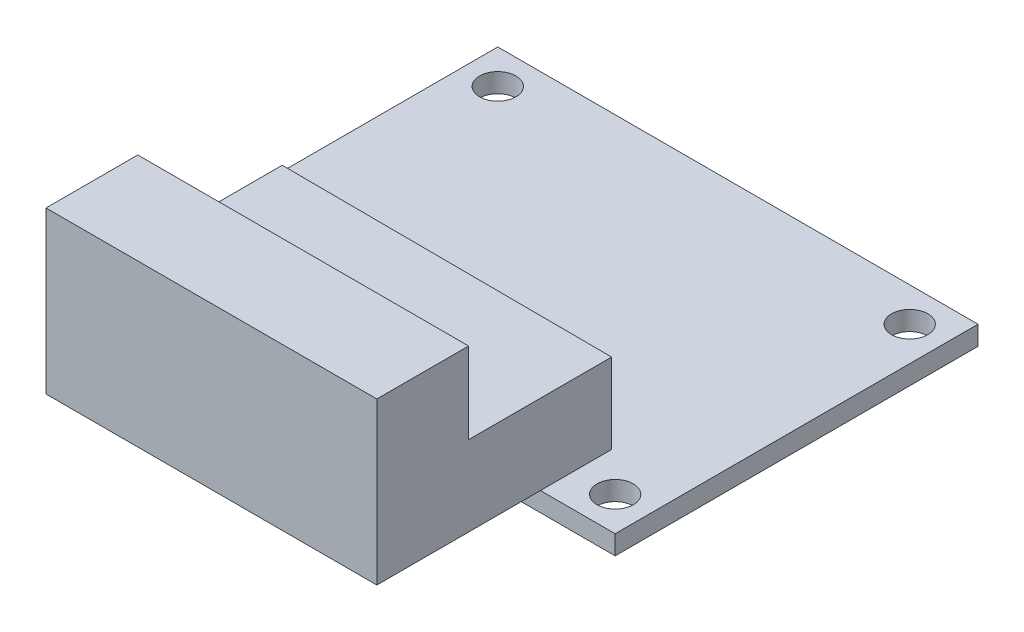
from build123d import *

# Parameters (mm, degrees)
SZKIC1_W                    = 45
SZKIC1_H                    = 34
DODANIE_WYCI_GNI_CIE1_DEPTH = 1.8
SZKIC2_R                    = 1.7
WYTNIJ_WYCI_GNI_CIE1_DEPTH  = 1.8
DODANIE_WYCI_GNI_CIE2_DEPTH = 7.5
SZKIC4_W                    = 31
SZKIC4_H                    = 8.6
DODANIE_WYCI_GNI_CIE3_DEPTH = 7.6


with BuildPart() as part:
    # Szkic1 → Dodanie-wyciągnięcie1 (new body)
    with BuildSketch(Plane(origin=(0, 0, 0), x_dir=(1, 0, 0), z_dir=(0, 1, 0))):
        with Locations((-2.969453376, -1.761254019)):
            Rectangle(SZKIC1_W, SZKIC1_H)
    extrude(amount=DODANIE_WYCI_GNI_CIE1_DEPTH)

    # Szkic2 → Wytnij-wyciągnięcie1 (cut)
    with BuildSketch(Plane(origin=(0, 1.8, 0), x_dir=(1, 0, 0), z_dir=(0, 1, 0))):
        with Locations(Location((-22.269453376, -15.561254019, 0), (0, 0, 270))):
            Circle(SZKIC2_R)
        with Locations(Location((16.330546624, -15.561254019, 0), (0, 0, 90))):
            Circle(SZKIC2_R)
        with Locations(Location((16.330546624, 12.038745981, 0), (0, 0, 270))):
            Circle(SZKIC2_R)
        with Locations(Location((-22.269453376, 12.038745981, 0), (0, 0, 90))):
            Circle(SZKIC2_R)
    extrude(amount=-WYTNIJ_WYCI_GNI_CIE1_DEPTH, mode=Mode.SUBTRACT)

    # Szkic3 → Dodanie-wyciągnięcie2 (add)
    with BuildSketch(Plane(origin=(0, 1.8, 0), x_dir=(1, 0, 0), z_dir=(0, 1, 0))):
        Polygon((-18.469453376, -34.093184344), (-18.469453376, -11.961254019), (12.530546624, -12.093184344), (12.530546624, -34.093184344), align=None)
    extrude(amount=DODANIE_WYCI_GNI_CIE2_DEPTH)

    # Szkic4 → Dodanie-wyciągnięcie3 (add)
    with BuildSketch(Plane(origin=(0, 9.3, 0), x_dir=(1, 0, 0), z_dir=(0, 1, 0))):
        with Locations((-2.969453376, -29.793184344)):
            Rectangle(SZKIC4_W, SZKIC4_H)
    extrude(amount=DODANIE_WYCI_GNI_CIE3_DEPTH)


solid = part.part
